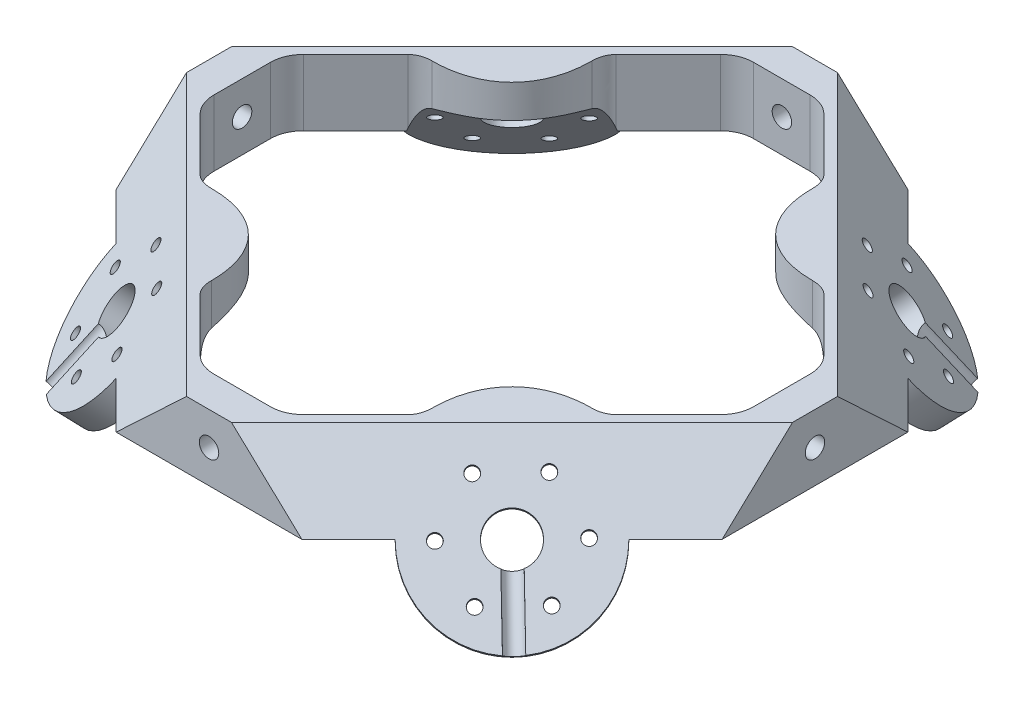
from build123d import *

# Parameters (mm, degrees)
SKETCH2_W                           = 91.65
SKETCH2_H                           = 91.65
SKETCH2_R                           = 3.175
BOSS_EXTRUDE2_DEPTH                 = 10
SKETCH4_W                           = 60
SKETCH4_H                           = 26.040805795
CUT_EXTRUDE1_DEPTH                  = 95.041169113
CUT_EXTRUDE2_REACH                  = 100.041
CUT_EXTRUDE2_START                  = -4
SKETCH5_R                           = 12.5
BOSS_EXTRUDE3_START                 = -4
SKETCH6_R                           = 12.5
BOSS_EXTRUDE3_DEPTH                 = 4
SKETCH7_R                           = 0.9
SKETCH7_R_2                         = 3.375
CUT_EXTRUDE3_DEPTH                  = 94.666046354
CUT_EXTRUDE8_REACH                  = 93.811
CUT_EXTRUDE8_END_RADIUS             = 3.375
SKETCH17_R                          = 1.25
CUT_EXTRUDE8_DIRECTION_2_REACH      = 93.811
CUT_EXTRUDE8_DIRECTION_2_END_RADIUS = 12.5
CIRPATTERN3_COUNT                   = 4
CUT_EXTRUDE13_DEPTH                 = 66.980136457
CUT_EXTRUDE14_DEPTH                 = 98.475946285
CIRPATTERN4_COUNT                   = 4
FILLET1_R                           = 5
FILLET2_R                           = 5
CUT_EXTRUDE15_DEPTH                 = 69.565169777
F_4_CLEARANCE_HOLE1_D               = 2.9464
F_4_CLEARANCE_HOLE1_ON_FACE_2_D     = 2.9464


with BuildPart() as part:
    # Sketch2 → Boss-Extrude2 (new body)
    with BuildSketch(Plane(origin=(0, 0, 0), x_dir=(1, 0, 0), z_dir=(0, 1, 0))):
        Rectangle(SKETCH2_W, SKETCH2_H)
        with Locations(Location((0, 0, 0), (0, 0, 270))):
            Circle(SKETCH2_R, mode=Mode.SUBTRACT)
    extrude(amount=BOSS_EXTRUDE2_DEPTH)

    # Sketch4 → Cut-Extrude1 (cut, through all)
    with BuildSketch(Plane(origin=(-19.096436864, 20.350812246, 19.096436864), x_dir=(0.7071067811865565, 0, 0.7071067811865386), z_dir=(-0.5647205848508117, 0.6018150231520467, 0.564720584850826))):
        with Locations((0, -25.981024002)):
            Rectangle(SKETCH4_W, SKETCH4_H)
    cut_extrude1 = extrude(amount=CUT_EXTRUDE1_DEPTH, mode=Mode.SUBTRACT)

    # Sketch5 → Cut-Extrude2 (cut, up to next)
    with BuildSketch(Plane(origin=(-19.096436864, 20.350812246, 19.096436864), x_dir=(0.8252821705609283, 0.41180743262081415, 0.3864246076435824), z_dir=(-0.5647205848508118, 0.6018150231520465, 0.5647205848508259)).offset(CUT_EXTRUDE2_START), mode=Mode.PRIVATE) as cut_extrude2_sk1:
        with Locations((-13.139495648, -21.833113403)):
            Circle(SKETCH5_R)
    cut_extrude2_tool1 = extrude(cut_extrude2_sk1.sketch, amount=-CUT_EXTRUDE2_REACH, mode=Mode.PRIVATE) & part.part
    cut_extrude2 = cut_extrude2_tool1.solids().sort_by_distance((-27.681346, -2.40726, 27.681346))[0]
    add(cut_extrude2, mode=Mode.SUBTRACT)

    # Sketch6 → Boss-Extrude3 (add)
    with BuildSketch(Plane(origin=(-16.837554525, 17.943552153, 16.837554525), x_dir=(0.8252821705609283, 0.4118074326208139, 0.3864246076435825), z_dir=(0.5647205848508118, -0.6018150231520466, -0.564720584850826)).offset(BOSS_EXTRUDE3_START)):
        with Locations((-13.139495648, 21.833113403)):
            Circle(SKETCH6_R)
    boss_extrude3 = extrude(amount=BOSS_EXTRUDE3_DEPTH)

    # Sketch7 → Cut-Extrude3 (cut, through all)
    with BuildSketch(Plane(origin=(-16.837554525, 17.943552153, 16.837554525), x_dir=(0.8252821705609283, 0.4118074326208139, 0.3864246076435825), z_dir=(0.5647205848508118, -0.6018150231520466, -0.564720584850826))):
        with Locations(Location((-13.139495648, 30.083113403, 0), (0, 0, 270))):
            Circle(SKETCH7_R)
        with Locations(Location((-20.284205229, 25.958113403, 0), (0, 0, 270))):
            Circle(SKETCH7_R)
        with Locations(Location((-20.284205229, 17.708113403, 0), (0, 0, 270))):
            Circle(SKETCH7_R)
        with Locations(Location((-13.139495648, 13.583113403, 0), (0, 0, 270))):
            Circle(SKETCH7_R)
        with Locations(Location((-5.994786067, 17.708113403, 0), (0, 0, 270))):
            Circle(SKETCH7_R)
        with Locations(Location((-5.994786067, 25.958113403, 0), (0, 0, 270))):
            Circle(SKETCH7_R)
        with Locations(Location((-13.139495648, 21.833113403, 0), (0, 0, 270))):
            Circle(SKETCH7_R_2)
    cut_extrude3 = extrude(amount=-CUT_EXTRUDE3_DEPTH, mode=Mode.SUBTRACT)

    # Cut-Extrude8: up to this cylinder (the profile starts outside it)
    cut_extrude8_end = Plane(origin=(-29.940228517, 1.75e-07, 29.940228517), z_dir=(0.5647205848508117, -0.6018150231520466, -0.564720584850826)) * Cylinder(CUT_EXTRUDE8_END_RADIUS, 195.372, mode=Mode.PRIVATE)
    # Sketch17 → Cut-Extrude8 (cut, up to the surface)
    with BuildSketch(Plane(origin=(-13.461378958, -26.049184363, 14.298881445), x_dir=(0.21931383976039828, 0.37994307836833885, 0.8986349074510408), z_dir=(-0.41264108528046395, -0.7985039080586604, 0.4383136360571131)), mode=Mode.PRIVATE) as cut_extrude8_sk1:
        with Locations((20.338213614, 27.019906778)):
            Circle(SKETCH17_R)
    cut_extrude8_tool1 = extrude(cut_extrude8_sk1.sketch, amount=-CUT_EXTRUDE8_REACH, mode=Mode.PRIVATE) - cut_extrude8_end
    cut_extrude8 = cut_extrude8_tool1.solids().sort_by_distance((-32.889165, -5.705093, 33.071132))[0]
    add(cut_extrude8, mode=Mode.SUBTRACT)

    # Cut-Extrude8 direction 2: up to this cylinder (the profile starts inside it)
    cut_extrude8_direction_2_end = Plane(origin=(-29.940228517, 1.75e-07, 29.940228517), z_dir=(0.5647205848508117, -0.6018150231520465, -0.564720584850826)) * Cylinder(CUT_EXTRUDE8_DIRECTION_2_END_RADIUS, 213.622, mode=Mode.PRIVATE)
    # Sketch17 → Cut-Extrude8 direction 2 (cut, up to the surface)
    with BuildSketch(Plane(origin=(-13.461378958, -26.049184363, 14.298881445), x_dir=(0.21931383976039828, 0.37994307836833885, 0.8986349074510408), z_dir=(-0.41264108528046395, -0.7985039080586604, 0.4383136360571131)), mode=Mode.PRIVATE) as cut_extrude8_direction_2_sk1:
        with Locations((20.338213614, 27.019906778)):
            Circle(SKETCH17_R)
    cut_extrude8_direction_2_tool1 = extrude(cut_extrude8_direction_2_sk1.sketch, amount=CUT_EXTRUDE8_DIRECTION_2_REACH, mode=Mode.PRIVATE) & cut_extrude8_direction_2_end
    cut_extrude8_direction_2 = cut_extrude8_direction_2_tool1.solids().sort_by_distance((-32.889165, -5.705093, 33.071132))[0]
    add(cut_extrude8_direction_2, mode=Mode.SUBTRACT)
    cut_extrude8 = cut_extrude8 + cut_extrude8_direction_2  # both directions under the feature's name, for the pattern or mirror that repeats it

    # CirPattern3: Cut-Extrude1, Cut-Extrude2, Boss-Extrude3, Cut-Extrude3, Cut-Extrude8 ×4 about axis
    cirpattern3_axis = Axis((0, 0, 0), (0, 1, 0))
    add([cut_extrude1.rotate(cirpattern3_axis, i * 360 / CIRPATTERN3_COUNT) for i in range(1, CIRPATTERN3_COUNT)], mode=Mode.SUBTRACT)
    add([cut_extrude2.rotate(cirpattern3_axis, i * 360 / CIRPATTERN3_COUNT) for i in range(1, CIRPATTERN3_COUNT)], mode=Mode.SUBTRACT)
    add([boss_extrude3.rotate(cirpattern3_axis, i * 360 / CIRPATTERN3_COUNT) for i in range(1, CIRPATTERN3_COUNT)])
    add([cut_extrude3.rotate(cirpattern3_axis, i * 360 / CIRPATTERN3_COUNT) for i in range(1, CIRPATTERN3_COUNT)], mode=Mode.SUBTRACT)
    add([cut_extrude8.rotate(cirpattern3_axis, i * 360 / CIRPATTERN3_COUNT) for i in range(1, CIRPATTERN3_COUNT)], mode=Mode.SUBTRACT)

    # Sketch18 → Cut-Extrude13 (cut, through all)
    with BuildSketch(Plane.XZ):
        with BuildLine():
            Line((-13.784538169, -33.390461831), (-6.35, -40.825))
            Line((-6.35, -40.825), (6.35, -40.825))
            Line((6.35, -40.825), (13.784538169, -33.390461831))
            add(Edge.make_bspline(
                [(13.784538169, -33.390461831), (13.205037919, -32.395087339), (12.688797298, -31.384320105), (11.329940177, -28.285682153), (10.712819736, -26.18152657), (10.313744387, -23.115705954), (10.268484123, -22.108606274), (10.368654279, -20.146613445), (10.514284149, -19.191446469), (11.010945817, -17.36441266), (11.362553987, -16.492535961), (12.274034214, -14.878315199), (12.834244548, -14.13675296), (14.13675296, -12.834244548), (14.878315199, -12.274034214), (16.492535961, -11.362553987), (17.36441266, -11.010945817), (19.191446469, -10.514284149), (20.146613445, -10.368654279), (22.108606274, -10.268484123), (23.115705954, -10.313744387), (26.18152657, -10.712819736), (28.285682153, -11.329940177), (31.384320105, -12.688797298), (32.395087339, -13.205037919), (33.390461831, -13.784538169)],
                knots=[0.064029245, 0.064029245, 0.064029245, 0.064029245, 0.125, 0.125, 0.25, 0.25, 0.3125, 0.3125, 0.375, 0.375, 0.4375, 0.4375, 0.5, 0.5, 0.5625, 0.5625, 0.625, 0.625, 0.6875, 0.6875, 0.75, 0.75, 0.875, 0.875, 0.935970755, 0.935970755, 0.935970755, 0.935970755], degree=3))
            Line((33.390461831, -13.784538169), (40.825, -6.35))
            Line((40.825, -6.35), (40.825, 6.35))
            Line((40.825, 6.35), (33.390461831, 13.784538169))
            add(Edge.make_bspline(
                [(33.390461831, 13.784538169), (32.395087339, 13.205037919), (31.384320105, 12.688797298), (28.285682153, 11.329940177), (26.18152657, 10.712819736), (23.115705954, 10.313744387), (22.108606274, 10.268484123), (20.146613445, 10.368654279), (19.191446469, 10.514284149), (17.36441266, 11.010945817), (16.492535961, 11.362553987), (14.878315199, 12.274034214), (14.13675296, 12.834244548), (12.834244548, 14.13675296), (12.274034214, 14.878315199), (11.362553987, 16.492535961), (11.010945817, 17.36441266), (10.514284149, 19.191446469), (10.368654279, 20.146613445), (10.268484123, 22.108606274), (10.313744387, 23.115705954), (10.712819736, 26.18152657), (11.329940177, 28.285682153), (12.688797298, 31.384320105), (13.205037919, 32.395087339), (13.784538169, 33.390461831)],
                knots=[0.064029245, 0.064029245, 0.064029245, 0.064029245, 0.125, 0.125, 0.25, 0.25, 0.3125, 0.3125, 0.375, 0.375, 0.4375, 0.4375, 0.5, 0.5, 0.5625, 0.5625, 0.625, 0.625, 0.6875, 0.6875, 0.75, 0.75, 0.875, 0.875, 0.935970755, 0.935970755, 0.935970755, 0.935970755], degree=3))
            Line((13.784538169, 33.390461831), (6.35, 40.825))
            Line((6.35, 40.825), (-6.35, 40.825))
            Line((-6.35, 40.825), (-13.784538169, 33.390461831))
            add(Edge.make_bspline(
                [(-33.390461831, 13.784538169), (-32.395087339, 13.205037919), (-31.384320105, 12.688797298), (-28.285682153, 11.329940177), (-26.18152657, 10.712819736), (-23.115705954, 10.313744387), (-22.108606274, 10.268484123), (-20.146613445, 10.368654279), (-19.191446469, 10.514284149), (-17.36441266, 11.010945817), (-16.492535961, 11.362553987), (-14.878315199, 12.274034214), (-14.13675296, 12.834244548), (-12.834244548, 14.13675296), (-12.274034214, 14.878315199), (-11.362553987, 16.492535961), (-11.010945817, 17.36441266), (-10.514284149, 19.191446469), (-10.368654279, 20.146613445), (-10.268484123, 22.108606274), (-10.313744387, 23.115705954), (-10.712819736, 26.18152657), (-11.329940177, 28.285682153), (-12.688797298, 31.384320105), (-13.205037919, 32.395087339), (-13.784538169, 33.390461831)],
                knots=[0.064029245, 0.064029245, 0.064029245, 0.064029245, 0.125, 0.125, 0.25, 0.25, 0.3125, 0.3125, 0.375, 0.375, 0.4375, 0.4375, 0.5, 0.5, 0.5625, 0.5625, 0.625, 0.625, 0.6875, 0.6875, 0.75, 0.75, 0.875, 0.875, 0.935970755, 0.935970755, 0.935970755, 0.935970755], degree=3))
            Line((-33.390461831, 13.784538169), (-40.825, 6.35))
            Line((-40.825, 6.35), (-40.825, -6.35))
            Line((-40.825, -6.35), (-33.390461831, -13.784538169))
            add(Edge.make_bspline(
                [(-13.784538169, -33.390461831), (-13.205037919, -32.395087339), (-12.688797298, -31.384320105), (-11.329940177, -28.285682153), (-10.712819736, -26.18152657), (-10.313744387, -23.115705954), (-10.268484123, -22.108606274), (-10.368654279, -20.146613445), (-10.514284149, -19.191446469), (-11.010945817, -17.36441266), (-11.362553987, -16.492535961), (-12.274034214, -14.878315199), (-12.834244548, -14.13675296), (-14.13675296, -12.834244548), (-14.878315199, -12.274034214), (-16.492535961, -11.362553987), (-17.36441266, -11.010945817), (-19.191446469, -10.514284149), (-20.146613445, -10.368654279), (-22.108606274, -10.268484123), (-23.115705954, -10.313744387), (-26.18152657, -10.712819736), (-28.285682153, -11.329940177), (-31.384320105, -12.688797298), (-32.395087339, -13.205037919), (-33.390461831, -13.784538169)],
                knots=[0.064029245, 0.064029245, 0.064029245, 0.064029245, 0.125, 0.125, 0.25, 0.25, 0.3125, 0.3125, 0.375, 0.375, 0.4375, 0.4375, 0.5, 0.5, 0.5625, 0.5625, 0.625, 0.625, 0.6875, 0.6875, 0.75, 0.75, 0.875, 0.875, 0.935970755, 0.935970755, 0.935970755, 0.935970755], degree=3))
        make_face()
    extrude(amount=-CUT_EXTRUDE13_DEPTH, mode=Mode.SUBTRACT)

    # Sketch21 → Cut-Extrude14 (cut, through all)
    with BuildSketch(Plane(origin=(-19.096436864, 20.350812246, 19.096436864), x_dir=(0.7071067811865565, 0, 0.7071067811865386), z_dir=(-0.5647205848508117, 0.6018150231520467, 0.564720584850826))):
        with BuildLine():
            Line((-13.863481572, 0), (-13.863481572, -12.088847452))
            Line((-13.863481572, -12.088847452), (-9.637118997, -12.088847452))
            ThreePointArc((-9.637118997, -12.088847452), (0, -8.981977685), (9.637118997, -12.088847452))
            Line((9.637118997, -12.088847452), (13.863481572, -12.088847452))
            Line((13.863481572, -12.088847452), (13.863481572, 0))
            Line((13.863481572, 0), (-13.863481572, 0))
        make_face()
    cut_extrude14 = extrude(amount=-CUT_EXTRUDE14_DEPTH, mode=Mode.SUBTRACT)

    # CirPattern4: Cut-Extrude14 ×4 about axis
    cirpattern4_axis = Axis((0, 0, 0), (0, 1, 0))
    for i in range(1, CIRPATTERN4_COUNT):
        add(cut_extrude14.rotate(cirpattern4_axis, i * 360 / CIRPATTERN4_COUNT), mode=Mode.SUBTRACT)

    # Fillet1
    fillet1_edges = [part.edges().sort_by_distance(p)[0] for p in [
        (33.390461831, 5, 13.784538169),
        (13.784538169, 5, 33.390461831),
        (6.35, 5, 40.825),
        (-6.35, 5, 40.825),
        (-13.784538169, 5, 33.390461831),
        (-33.390461831, 5, 13.784538169),
        (-40.825, 5, 6.35),
        (-40.825, 5, -6.35),
        (-33.390461831, 5, -13.784538169),
        (-13.784538169, 5, -33.390461831),
        (-6.35, 5, -40.825),
        (6.35, 5, -40.825),
        (13.784538169, 5, -33.390461831),
        (33.390461831, 5, -13.784538169),
        (40.825, 5, -6.35),
        (40.825, 5, 6.35),
    ]]
    fillet(fillet1_edges, radius=FILLET1_R)

    # Fillet2
    fillet2_edges = [part.edges().sort_by_distance(p)[0] for p in [
        (-27.23428857, 6.624242777, -13.605344183),
        (-13.605344183, 6.624242777, -27.23428857),
        (27.23428857, 6.624242777, -13.605344183),
        (13.605344183, 6.624242777, -27.23428857),
        (-27.23428857, 6.624242777, 13.605344183),
        (-13.605344183, 6.624242777, 27.23428857),
        (13.605344183, 6.624242777, 27.23428857),
        (27.23428857, 6.624242777, 13.605344183),
    ]]
    fillet(fillet2_edges, radius=FILLET2_R)

    # Sketch23 → Cut-Extrude15 (cut, through all)
    with BuildSketch(Plane(origin=(0, 10, 0), x_dir=(1, 0, 0), z_dir=(0, 1, 0))):
        with BuildLine():
            add(Edge.make_bspline(
                [(28.780009203, -16.697112464), (16.662347974, -16.662347974), (16.697112464, -28.780009203)],
                knots=[2.597301258, 2.597301258, 2.597301258, 3.685884049, 3.685884049, 3.685884049], degree=2, weights=[1, 0.855494429, 1]))
            add(Edge.make_bspline(
                [(15.7153097, -31.4596903), (16.701969591, -30.47303041), (16.697112464, -28.780009203)],
                knots=[0, 0, 0, 0.544291396, 0.544291396, 0.544291396], degree=2, weights=[1, 0.963196353, 1]))
            Line((15.7153097, -31.4596903), (11.219071643, -35.955928357))
            Line((11.219071643, -35.955928357), (7.814466094, -39.360533906))
            ThreePointArc((7.814466094, -39.360533906), (6.19234935, -40.444397663), (4.278932188, -40.825))
            Line((4.278932188, -40.825), (-4.278932188, -40.825))
            ThreePointArc((-4.278932188, -40.825), (-6.19234935, -40.444397663), (-7.814466094, -39.360533906))
            Line((-7.814466094, -39.360533906), (-11.219071643, -35.955928356))
            Line((-11.219071643, -35.955928356), (-15.7153097, -31.4596903))
            add(Edge.make_bspline(
                [(-16.697112464, -28.780009203), (-16.701969591, -30.47303041), (-15.7153097, -31.4596903)],
                knots=[5.738893912, 5.738893912, 5.738893912, 6.283185307, 6.283185307, 6.283185307], degree=2, weights=[1, 0.963196353, 1]))
            add(Edge.make_bspline(
                [(-16.697112464, -28.780009203), (-16.662347974, -16.662347974), (-28.780009203, -16.697112464)],
                knots=[2.597301258, 2.597301258, 2.597301258, 3.685884049, 3.685884049, 3.685884049], degree=2, weights=[1, 0.855494429, 1]))
            add(Edge.make_bspline(
                [(-31.4596903, -15.7153097), (-30.47303041, -16.701969591), (-28.780009203, -16.697112464)],
                knots=[0, 0, 0, 0.544291396, 0.544291396, 0.544291396], degree=2, weights=[1, 0.963196353, 1]))
            Line((-31.4596903, -15.7153097), (-35.955928357, -11.219071643))
            Line((-35.955928357, -11.219071643), (-39.360533906, -7.814466094))
            ThreePointArc((-39.360533906, -7.814466094), (-40.444397663, -6.19234935), (-40.825, -4.278932188))
            Line((-40.825, -4.278932188), (-40.825, 4.278932188))
            ThreePointArc((-40.825, 4.278932188), (-40.444397663, 6.19234935), (-39.360533906, 7.814466094))
            Line((-39.360533906, 7.814466094), (-35.955928356, 11.219071643))
            Line((-35.955928356, 11.219071643), (-31.4596903, 15.7153097))
            add(Edge.make_bspline(
                [(-28.780009203, 16.697112464), (-30.47303041, 16.701969591), (-31.4596903, 15.7153097)],
                knots=[5.738893912, 5.738893912, 5.738893912, 6.283185307, 6.283185307, 6.283185307], degree=2, weights=[1, 0.963196353, 1]))
            add(Edge.make_bspline(
                [(-28.780009203, 16.697112464), (-16.662347974, 16.662347974), (-16.697112464, 28.780009203)],
                knots=[2.597301258, 2.597301258, 2.597301258, 3.685884049, 3.685884049, 3.685884049], degree=2, weights=[1, 0.855494429, 1]))
            add(Edge.make_bspline(
                [(-15.7153097, 31.4596903), (-16.701969591, 30.47303041), (-16.697112464, 28.780009203)],
                knots=[0, 0, 0, 0.544291396, 0.544291396, 0.544291396], degree=2, weights=[1, 0.963196353, 1]))
            Line((-15.7153097, 31.4596903), (-11.219071643, 35.955928357))
            Line((-11.219071643, 35.955928357), (-7.814466094, 39.360533906))
            ThreePointArc((-7.814466094, 39.360533906), (-6.19234935, 40.444397663), (-4.278932188, 40.825))
            Line((-4.278932188, 40.825), (4.278932188, 40.825))
            ThreePointArc((4.278932188, 40.825), (6.19234935, 40.444397663), (7.814466094, 39.360533906))
            Line((7.814466094, 39.360533906), (11.219071643, 35.955928356))
            Line((11.219071643, 35.955928356), (15.7153097, 31.4596903))
            add(Edge.make_bspline(
                [(16.697112464, 28.780009203), (16.701969591, 30.47303041), (15.7153097, 31.4596903)],
                knots=[5.738893912, 5.738893912, 5.738893912, 6.283185307, 6.283185307, 6.283185307], degree=2, weights=[1, 0.963196353, 1]))
            add(Edge.make_bspline(
                [(16.697112464, 28.780009203), (16.662347974, 16.662347974), (28.780009203, 16.697112464)],
                knots=[2.597301258, 2.597301258, 2.597301258, 3.685884049, 3.685884049, 3.685884049], degree=2, weights=[1, 0.855494429, 1]))
            add(Edge.make_bspline(
                [(31.4596903, 15.7153097), (30.47303041, 16.701969591), (28.780009203, 16.697112464)],
                knots=[0, 0, 0, 0.544291396, 0.544291396, 0.544291396], degree=2, weights=[1, 0.963196353, 1]))
            Line((31.4596903, 15.7153097), (35.955928357, 11.219071643))
            Line((35.955928357, 11.219071643), (39.360533906, 7.814466094))
            ThreePointArc((39.360533906, 7.814466094), (40.444397663, 6.19234935), (40.825, 4.278932188))
            Line((40.825, 4.278932188), (40.825, -4.278932188))
            ThreePointArc((40.825, -4.278932188), (40.444397663, -6.19234935), (39.360533906, -7.814466094))
            Line((39.360533906, -7.814466094), (35.955928356, -11.219071643))
            Line((35.955928356, -11.219071643), (31.4596903, -15.7153097))
            add(Edge.make_bspline(
                [(28.780009203, -16.697112464), (30.47303041, -16.701969591), (31.4596903, -15.7153097)],
                knots=[5.738893912, 5.738893912, 5.738893912, 6.283185307, 6.283185307, 6.283185307], degree=2, weights=[1, 0.963196353, 1]))
        make_face()
    extrude(amount=-CUT_EXTRUDE15_DEPTH, mode=Mode.SUBTRACT)

    # #4 Clearance Hole1 (through all)
    with Locations(Plane(origin=(0, 5, 45.825), x_dir=(1, 0, 0), z_dir=(0, 0, 1))):
        with Locations((0, 0)):
            Hole(F_4_CLEARANCE_HOLE1_D / 2)

    # #4 Clearance Hole1 on face 2 (through all)
    with Locations(Plane(origin=(45.825, 5, 0), x_dir=(0, 0, 1), z_dir=(1, 0, 0))):
        with Locations((0, 0)):
            Hole(F_4_CLEARANCE_HOLE1_ON_FACE_2_D / 2)


solid = part.part
